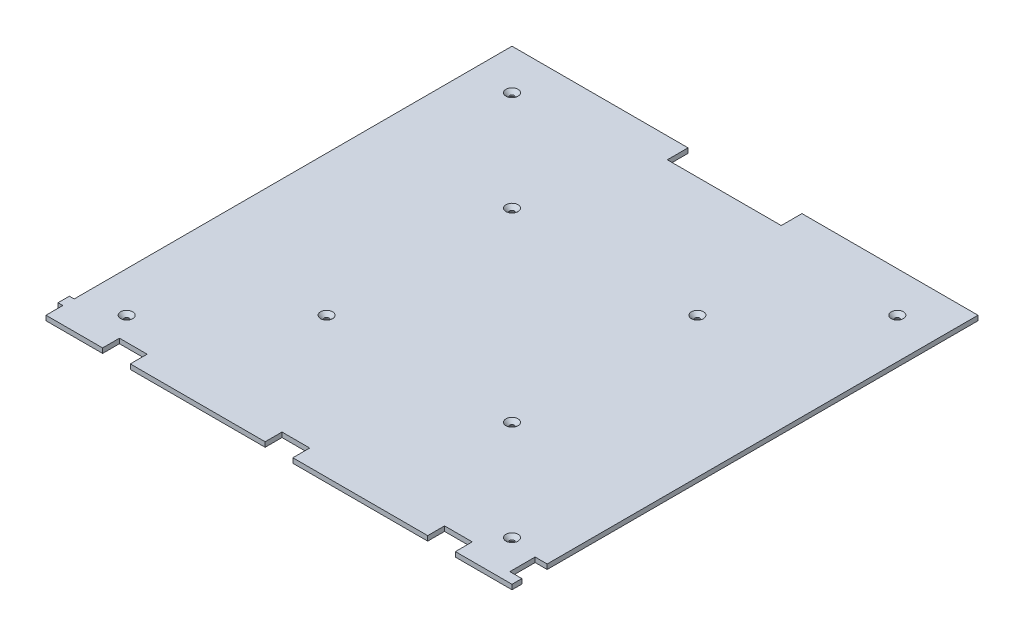
from build123d import *

# Parameters (mm, degrees)
BOSS_EXTRUDE1_DEPTH     = 2
CUT_EXTRUDE1_DEPTH      = 139.261075506
CUT_EXTRUDE1_DEPTH_BACK = 139.261075506
SKETCH2_R               = 1
CHAMFER1_SIZE           = 1.5


with BuildPart() as part:
    # Sketch1 → Boss-Extrude1 (new body)
    with BuildSketch(Plane(origin=(0, 0, 0), x_dir=(1, 0, 0), z_dir=(0, 1, 0))):
        Polygon((5.75, -96.75), (61.746519787, -96.75), (61.746519787, -89.753578842), (73.246519787, -89.753578842), (73.246519787, -96.75), (96.75, -96.75), (96.75, -92.65), (91.75, -92.65), (91.75, -82.15), (96.75, -82.15), (96.75, 96.75), (23.65, 96.75), (23.65, 88.15), (-23.65, 88.15), (-23.65, 96.75), (-96.75, 96.75), (-96.75, -85.05), (-98.75, -85.05), (-98.75, -89.75), (-96.75, -89.75), (-96.75, -96.75), (-73.246519787, -96.75), (-73.246519787, -89.753578842), (-61.746519787, -89.753578842), (-61.746519787, -96.75), (-5.75, -96.75), (-5.75, -89.753578842), (5.75, -89.753578842), align=None)
    extrude(amount=BOSS_EXTRUDE1_DEPTH)

    # Sketch2 → Cut-Extrude1 (cut, two sides: drawn at the far end of the back side and taken through both)
    with BuildSketch(Plane.XZ.offset(-CUT_EXTRUDE1_DEPTH_BACK)):
        with Locations(Location((80, 80, 0), (0, 0, 270))):
            Circle(SKETCH2_R)
        with Locations(Location((-80, 80, 0), (0, 0, 270))):
            Circle(SKETCH2_R)
        with Locations(Location((-38.5, 38.5, 0), (0, 0, 270))):
            Circle(SKETCH2_R)
        with Locations(Location((38.5, 38.5, 0), (0, 0, 270))):
            Circle(SKETCH2_R)
        with Locations(Location((80, -80, 0), (0, 0, 270))):
            Circle(SKETCH2_R)
        with Locations(Location((-80, -80, 0), (0, 0, 270))):
            Circle(SKETCH2_R)
        with Locations(Location((38.5, -38.5, 0), (0, 0, 270))):
            Circle(SKETCH2_R)
        with Locations(Location((-38.5, -38.5, 0), (0, 0, 270))):
            Circle(SKETCH2_R)
    extrude(amount=CUT_EXTRUDE1_DEPTH + CUT_EXTRUDE1_DEPTH_BACK, mode=Mode.SUBTRACT)

    # Chamfer1
    chamfer1_edges = [part.edges().sort_by_distance(p)[0] for p in [
        (-80, 2, 81),
        (-38.5, 2, 39.5),
        (38.5, 2, 39.5),
        (80, 2, -79),
        (-38.5, 2, -37.5),
        (38.5, 2, -37.5),
        (-80, 2, -79),
        (80, 2, 81),
    ]]
    chamfer(chamfer1_edges, length=CHAMFER1_SIZE)


solid = part.part
